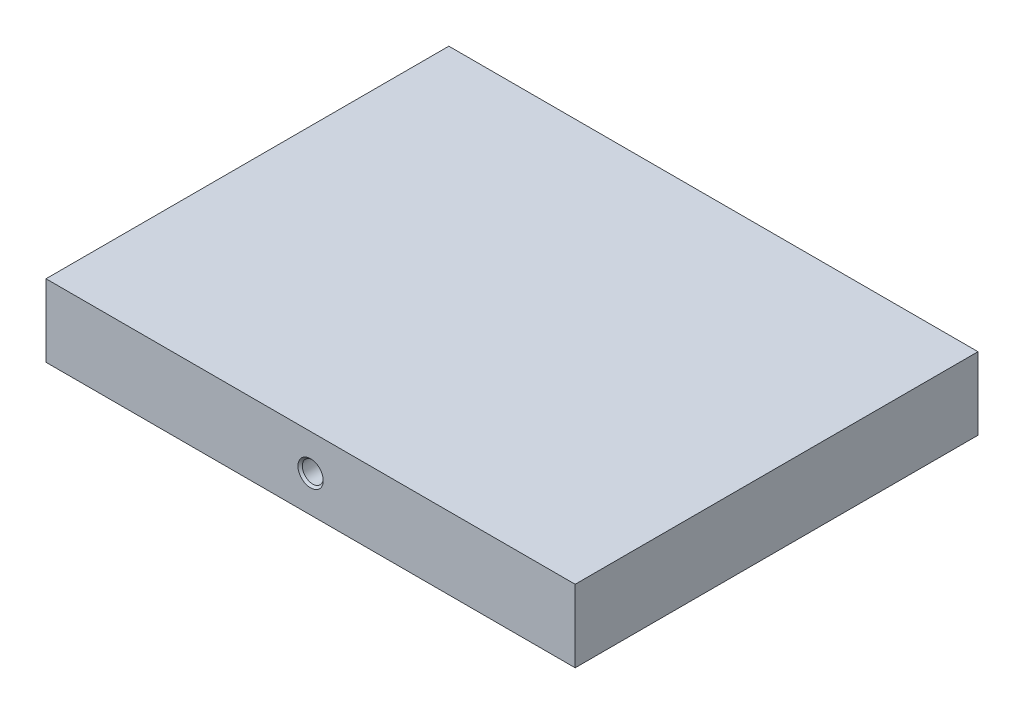
from build123d import *

# Parameters (mm, degrees)
SKETCH_1_W                   = 126.5
SKETCH_1_H                   = 96.3
EXTRUDE_1_DEPTH              = 17.3
HOLE_WIZARD_M6_1_D           = 5
HOLE_WIZARD_M6_1_DEPTH       = 8
HOLE_WIZARD_M6_1_CSINK_D     = 6.05
HOLE_WIZARD_M6_1_CSINK_ANGLE = 90
HOLE_WIZARD_M6_1_TIP         = 1.502151548
SKETCH_4_R                   = 1.9
EXTRUDE_2_DEPTH              = 1.2
EXTRUDE_2_2_DEPTH            = 1.2
EXTRUDE_2_3_DEPTH            = 1.2
EXTRUDE_2_4_DEPTH            = 1.2
EXTRUDE_2_5_DEPTH            = 1.2
SKETCH_5_W                   = 9
SKETCH_5_H                   = 3.5
CUT_EXTRUDE_1_DEPTH          = 5
HOLE_WIZARD_M4_1_AT_2_COUNT  = 2
HOLE_WIZARD_M4_1_AT_2_PITCH  = 75


with BuildPart() as part:
    # 草图1 → 凸台-拉伸1 (new body)
    with BuildSketch(Plane(origin=(0, 0, 0), x_dir=(1, 0, 0), z_dir=(0, 1, 0))):
        Rectangle(SKETCH_1_W, SKETCH_1_H)
    extrude(amount=EXTRUDE_1_DEPTH)

    # M6 螺纹孔1
    with Locations(Plane.XY.offset(48.15)):
        with Locations((0, 8.65)):
            CounterSinkHole(HOLE_WIZARD_M6_1_D / 2, HOLE_WIZARD_M6_1_CSINK_D / 2, depth=HOLE_WIZARD_M6_1_DEPTH, counter_sink_angle=HOLE_WIZARD_M6_1_CSINK_ANGLE)
            with Locations((0, 0, -(HOLE_WIZARD_M6_1_DEPTH + HOLE_WIZARD_M6_1_TIP / 2))):  # 118° drill point
                Cone(0, HOLE_WIZARD_M6_1_D / 2, HOLE_WIZARD_M6_1_TIP, mode=Mode.SUBTRACT)

    # 草图5 → 切除-拉伸1 (cut)
    with BuildSketch(Plane.ZY.offset(63.25)):
        with Locations((27.25, 5.6)):
            Rectangle(SKETCH_5_W, SKETCH_5_H)
    extrude(amount=-CUT_EXTRUDE_1_DEPTH, mode=Mode.SUBTRACT)

    # 草图7 → M4 螺纹孔1 (revolve, cut)
    with BuildSketch(Plane(origin=(37.5, 0, 0), x_dir=(0, 0, -1), z_dir=(1, 0, 0))):
        Polygon((0, 0), (0, 6.091420021), (1.65, 5.1), (1.65, 0.375), (2.025, 0), align=None)
    hole_wizard_m4_1 = revolve(axis=Axis((37.5, -6.35, 0), (0, 1, 0)), mode=Mode.SUBTRACT)

    # M4 螺纹孔1 at 2: M4 螺纹孔1 ×2
    with Locations(*[(-i * HOLE_WIZARD_M4_1_AT_2_PITCH, 0, 0) for i in range(1, HOLE_WIZARD_M4_1_AT_2_COUNT)]):
        add(hole_wizard_m4_1, mode=Mode.SUBTRACT)


with BuildPart() as body_2:
    # 草图4 → 凸台-拉伸2 (new body)
    with BuildSketch(Plane.ZY.offset(63.25)):
        with Locations((-30.75, 5.6)):
            Circle(SKETCH_4_R)
    extrude(amount=EXTRUDE_2_DEPTH)


with BuildPart() as body_3:
    # 草图4 → Extrude 2 2 (new body)
    with BuildSketch(Plane.ZY.offset(63.25)):
        with Locations((-19.25, 5.6)):
            Circle(SKETCH_4_R)
    extrude(amount=EXTRUDE_2_2_DEPTH)


with BuildPart() as body_4:
    # 草图4 → Extrude 2 3 (new body)
    with BuildSketch(Plane.ZY.offset(63.25)):
        with Locations((-7.75, 5.6)):
            Circle(SKETCH_4_R)
    extrude(amount=EXTRUDE_2_3_DEPTH)


with BuildPart() as body_5:
    # 草图4 → Extrude 2 4 (new body)
    with BuildSketch(Plane.ZY.offset(63.25)):
        with Locations((3.75, 5.6)):
            Circle(SKETCH_4_R)
    extrude(amount=EXTRUDE_2_4_DEPTH)


with BuildPart() as body_6:
    # 草图4 → Extrude 2 5 (new body)
    with BuildSketch(Plane.ZY.offset(63.25)):
        with Locations((15.25, 5.6)):
            Circle(SKETCH_4_R)
    extrude(amount=EXTRUDE_2_5_DEPTH)


solid = Compound([part.part, body_2.part, body_3.part, body_4.part, body_5.part, body_6.part])
